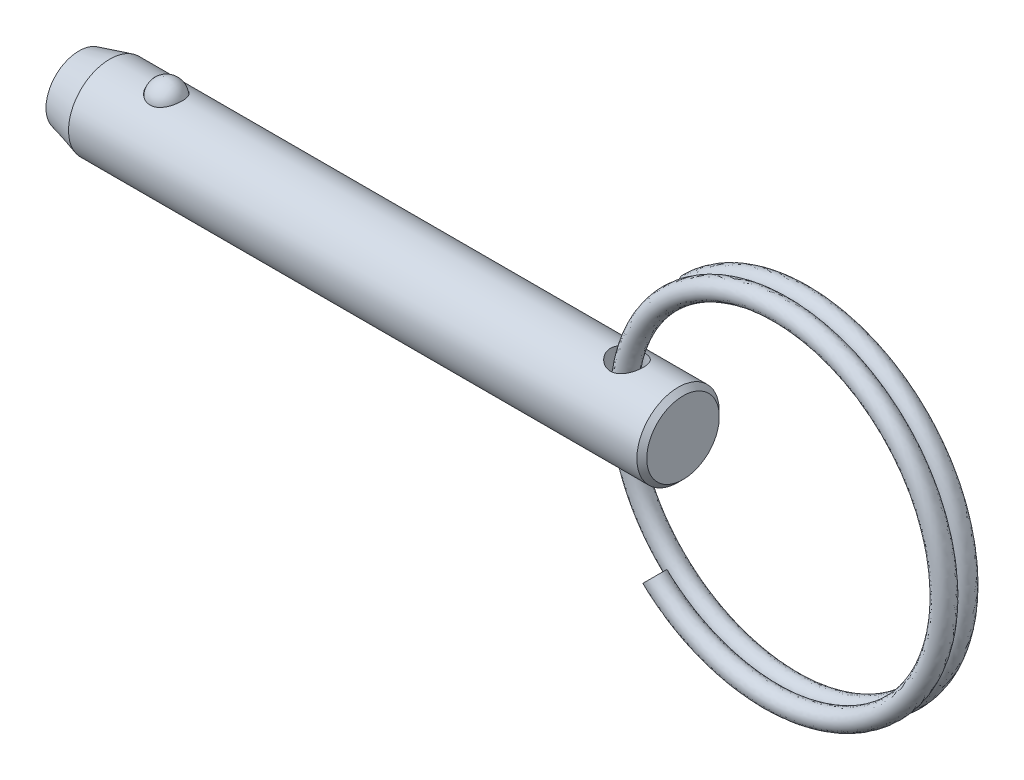
from build123d import *

# Parameters (mm, degrees)
SKETCH4_W          = 1.27
SKETCH4_H          = 6.35
SWEEP1_PITCH       = 1.5494
SWEEP1_HEIGHT      = 1.355725
SWEEP1_RADIUS      = 13.462
SKETCH6_R          = 0.762
SWEEP2_PITCH       = 1.5494
SWEEP2_HEIGHT      = 1.355725
SWEEP2_RADIUS      = 13.462
SWEEP2_START_ANGLE = -180
SKETCH6_2_R        = 0.762


with BuildPart() as part:
    # Sketch1 → Revolve1 (revolve)
    with BuildSketch(Plane.XY, mode=Mode.PRIVATE) as revolve1_sk:
        Polygon((5.588, 2.794), (5.207, 3.175), (-38.574947737, 3.175), (-40.9448, 2.54), (-40.9448, 0), (5.588, 0), align=None)
    revolve(revolve1_sk.sketch.rotate(Axis((5.588, 0, 0), (1, 0, 0)), 90), axis=Axis((5.588, 0, 0), (1, 0, 0)))

    # Sketch2 → Cut-Revolve1 (revolve, cut)
    with BuildSketch(Plane.XY):
        with BuildLine():
            Line((-32.952982051, 2.8575), (-35.467582051, 2.8575))
            ThreePointArc((-35.467582051, 2.8575), (-34.210282051, 4.1148), (-32.952982051, 2.8575))
        make_face()
    revolve(axis=Axis((-32.952982051, 2.8575, 0), (1, 0, 0)), mode=Mode.SUBTRACT)

    # Sketch4 → Cut-Revolve2 (revolve, cut)
    with BuildSketch(Plane.XY, mode=Mode.PRIVATE) as cut_revolve2_sk:
        with Locations((1.905, 0)):
            Rectangle(SKETCH4_W, SKETCH4_H)
    revolve(cut_revolve2_sk.sketch.rotate(Axis((1.27, -3.175, 0), (0, 1, 0)), 90), axis=Axis((1.27, -3.175, 0), (0, 1, 0)), mode=Mode.SUBTRACT)


with BuildPart() as body_2:
    # Sketch3 → Revolve2 (revolve)
    with BuildSketch(Plane.XY):
        with BuildLine():
            Line((-32.978382051, 2.8575), (-35.442182051, 2.8575))
            ThreePointArc((-35.442182051, 2.8575), (-34.210282051, 4.0894), (-32.978382051, 2.8575))
        make_face()
    revolve(axis=Axis((-32.978382051, 2.8575, 0), (1, 0, 0)))


with BuildPart() as body_3:
    # Sweep1: sweep along a helix
    with BuildLine() as sweep1_path:
        Helix(SWEEP1_PITCH, SWEEP1_HEIGHT, SWEEP1_RADIUS, center=(13.755025091, 0, 0), direction=(0, 0, -1), lefthand=True)
    # Sketch6 → Sweep1 (sweep)
    with BuildSketch(Plane(origin=(114.003847968, 0, 0), x_dir=(0, 0, -1), z_dir=(0, 1, 0))):
        with Locations((0, 112.948822877)):
            Circle(SKETCH6_R)
    sweep(path=sweep1_path.line, is_frenet=True)

    # Sweep2: sweep along a helix
    with BuildLine() as sweep2_path:
        add(Helix(SWEEP2_PITCH, SWEEP2_HEIGHT, SWEEP2_RADIUS, center=(13.755025091, 0, 0), direction=(0, 0, 1), lefthand=True, mode=Mode.PRIVATE).rotate(Axis((13.755025091, 0, 0), (0, 0, 1)), SWEEP2_START_ANGLE))
    # Sketch6<2> → Sweep2 (sweep)
    with BuildSketch(Plane(origin=(114.003847968, 0, 0), x_dir=(0, 0, -1), z_dir=(0, 1, 0))):
        with Locations((0, 112.948822877)):
            Circle(SKETCH6_2_R)
    sweep(path=sweep2_path.line, is_frenet=True)


solid = Compound([part.part, body_2.part, body_3.part])
